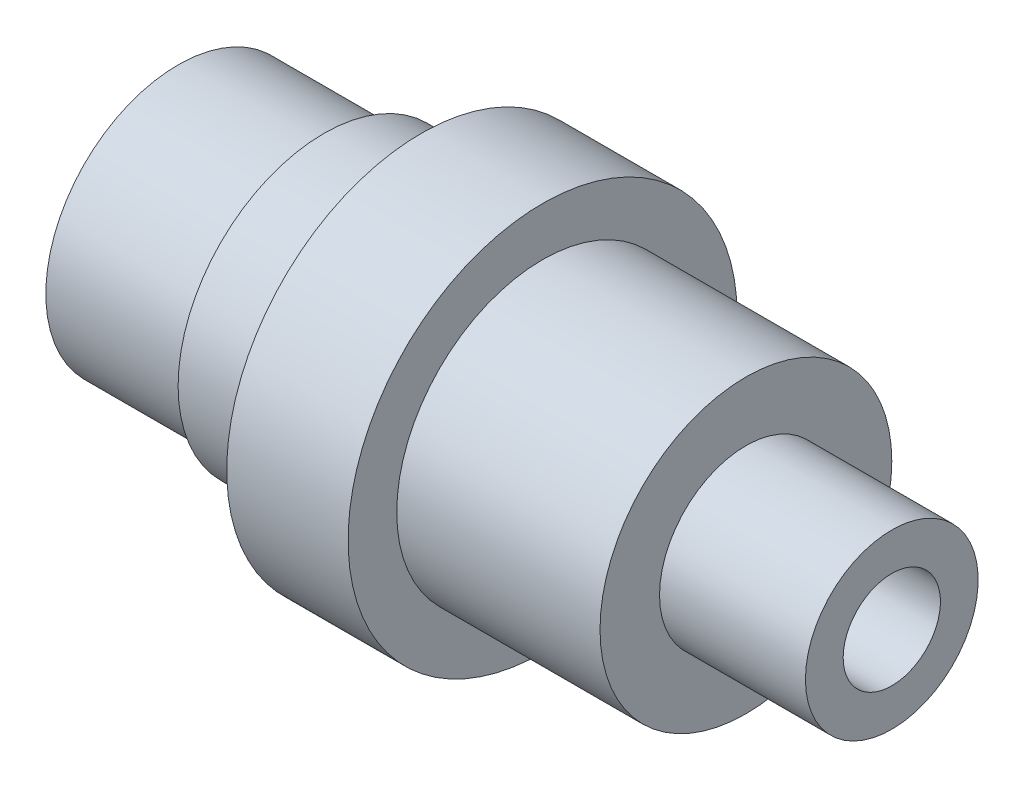
from build123d import *

# Parameters (mm, degrees)
SKETCH1_R           = 12.7
BOSS_EXTRUDE1_DEPTH = 7.9248
SKETCH2_R           = 9.525
BOSS_EXTRUDE2_DEPTH = 13.2715
SKETCH3_R           = 5.6388
BOSS_EXTRUDE3_DEPTH = 9.525
BOSS_EXTRUDE4_START = 6.35
SKETCH4_R           = 9.525
BOSS_EXTRUDE4_DEPTH = 6.35
SKETCH5_R           = 8.636
BOSS_EXTRUDE5_DEPTH = 9.525
SKETCH6_R           = 6.35
CUT_EXTRUDE1_DEPTH  = 25.4
SKETCH7_R           = 3.175
CUT_EXTRUDE2_DEPTH  = 32.108519733


with BuildPart() as part:
    # Sketch1 → Boss-Extrude1 (new body)
    with BuildSketch(Plane(origin=(0, 0, 0), x_dir=(0, 0, -1), z_dir=(1, 0, 0))):
        Circle(SKETCH1_R)
    extrude(amount=BOSS_EXTRUDE1_DEPTH)

    # Sketch2 → Boss-Extrude2 (add)
    with BuildSketch(Plane(origin=(7.9248, 0, 0), x_dir=(0, 0, -1), z_dir=(1, 0, 0))):
        Circle(SKETCH2_R)
    extrude(amount=BOSS_EXTRUDE2_DEPTH)

    # Sketch3 → Boss-Extrude3 (add)
    with BuildSketch(Plane(origin=(21.1963, 0, 0), x_dir=(0, 0, -1), z_dir=(1, 0, 0))):
        with Locations(Location((0, 0, 0), (0, 0, 180))):
            Circle(SKETCH3_R)
    extrude(amount=BOSS_EXTRUDE3_DEPTH)

    # Sketch4 → Boss-Extrude4 (add)
    with BuildSketch(Plane.ZY.offset(BOSS_EXTRUDE4_START)):
        with Locations(Location((0, 0, 0), (0, 0, 180))):
            Circle(SKETCH4_R)
    extrude(amount=-BOSS_EXTRUDE4_DEPTH)

    # Sketch5 → Boss-Extrude5 (add)
    with BuildSketch(Plane.ZY.offset(6.35)):
        with Locations(Location((0, 0, 0), (0, 0, 180))):
            Circle(SKETCH5_R)
    extrude(amount=BOSS_EXTRUDE5_DEPTH)

    # Sketch6 → Cut-Extrude1 (cut)
    with BuildSketch(Plane.ZY.offset(15.875)):
        Circle(SKETCH6_R)
    extrude(amount=-CUT_EXTRUDE1_DEPTH, mode=Mode.SUBTRACT)

    # Sketch7 → Cut-Extrude2 (cut, through all)
    with BuildSketch(Plane.ZY.offset(-9.525)):
        Circle(SKETCH7_R)
    extrude(amount=-CUT_EXTRUDE2_DEPTH, mode=Mode.SUBTRACT)


solid = part.part
